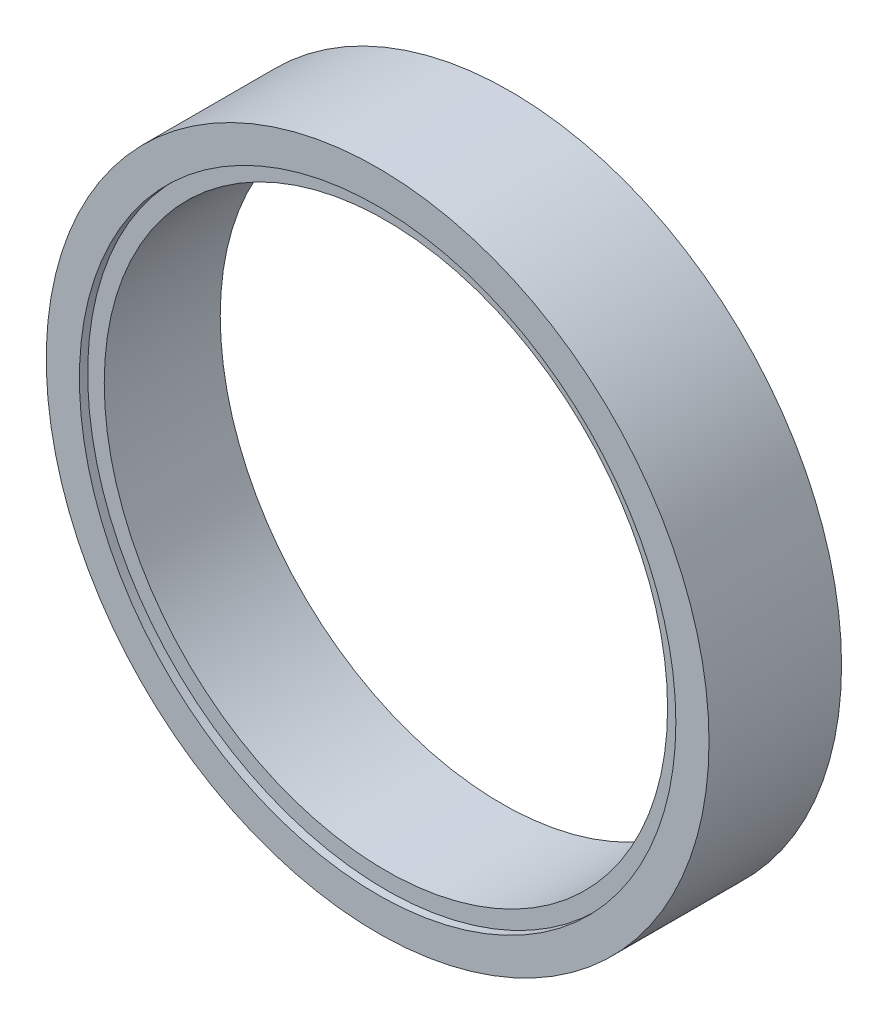
from build123d import *

# Parameters (mm, degrees)
SKETCH1_R           = 63.5
SKETCH1_R_2         = 53.975
BOSS_EXTRUDE1_DEPTH = 12.7
SKETCH2_R           = 57.15
CUT_EXTRUDE1_DEPTH  = 1.5875
CUT_EXTRUDE2_START  = -1.5875
SKETCH3_R           = 57.15
CUT_EXTRUDE2_DEPTH  = 1.5875


with BuildPart() as part:
    # Sketch1 → Boss-Extrude1 (new, symmetric)
    with BuildSketch(Plane.XY):
        Circle(SKETCH1_R)
        Circle(SKETCH1_R_2, mode=Mode.SUBTRACT)
    extrude(amount=BOSS_EXTRUDE1_DEPTH, both=True)

    # Sketch2 → Cut-Extrude1 (cut)
    with BuildSketch(Plane.XY.offset(12.7)):
        Circle(SKETCH2_R)
    extrude(amount=-CUT_EXTRUDE1_DEPTH, mode=Mode.SUBTRACT)

    # Sketch3 → Cut-Extrude2 (cut)
    with BuildSketch(Plane(origin=(0, 0, -12.7), x_dir=(-1, 0, 0), z_dir=(0, 0, -1)).offset(CUT_EXTRUDE2_START)):
        with Locations(Location((0, 0, 0), (0, 0, 180))):
            Circle(SKETCH3_R)
    extrude(amount=CUT_EXTRUDE2_DEPTH, mode=Mode.SUBTRACT)


solid = part.part
